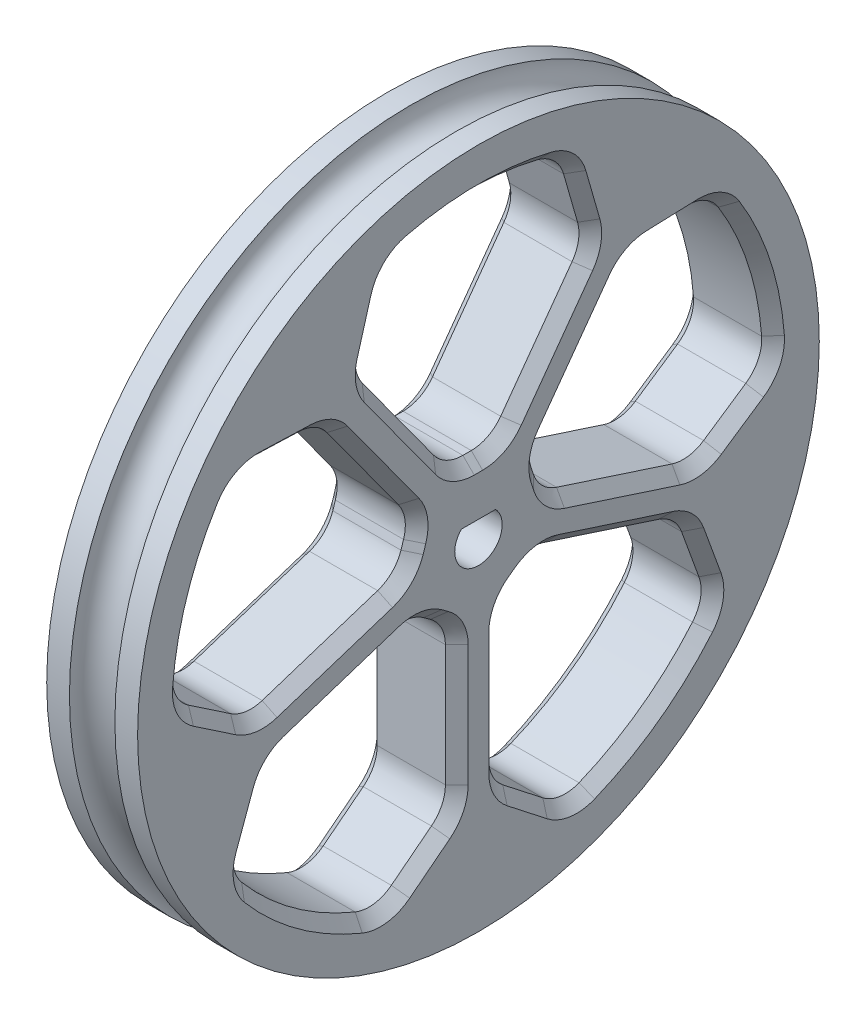
from build123d import *

# Parameters (mm, degrees)
CUT_EXTRUDE1_REACH             = 35.825
CUT_EXTRUDE1_DIRECTION_2_REACH = 35.825
CUT_EXTRUDE2_REACH             = 35.825
CUT_EXTRUDE2_DIRECTION_2_REACH = 35.825
FILLET1_R                      = 2.54
CHAMFER1_SIZE                  = 0.79375
CIRPATTERN3_COUNT              = 5
FILLET1_OF_CIRPATTERN3_R       = 2.54
CHAMFER1_OF_CIRPATTERN3_SIZE   = 0.79375


with BuildPart() as part:
    # Sketch1 → Revolve1 (revolve)
    with BuildSketch(Plane.XY):
        with BuildLine():
            Line((-3.175000000000003, 23.8125), (-1.5875, 23.8125))
            ThreePointArc((-1.5875, 23.8125), (-2.9e-16, 22.225), (1.5875, 23.8125))
            Line((1.5875, 23.8125), (3.175000000000003, 23.8125))
            Line((3.175000000000003, 23.8125), (3.175000000000018, 0))
            Line((3.175000000000018, 0), (-3.175000000000018, 0))
            Line((-3.175000000000018, 0), (-3.175000000000003, 23.8125))
        make_face()
    revolve(axis=Axis((-3.175000000000018, 0, 0), (1, 0, 0)))

    # Cut-Extrude1: up to this face of the body (flat: up to its plane)
    cut_extrude1_end = Plane(part.part.faces().sort_by_distance((3.175, 0, 0))[0])
    # Sketch3 → Cut-Extrude1 (cut, up to the picked face)
    with BuildSketch(Plane(origin=(0, 0, 0), x_dir=(0, 0, -1), z_dir=(1, 0, 0)), mode=Mode.PRIVATE) as cut_extrude1_sk1:
        with BuildLine():
            Line((8.060345380986481, 13.671607356395112), (6.35, 19.636290542004108))
            ThreePointArc((6.3500000000000005, 19.636290542004108), (-1.78e-15, 20.63749999999998), (-6.350000000000003, 19.636290542004108))
            Line((-6.35, 19.636290542004108), (-8.060345380986481, 13.67160735639511))
            Line((-8.060345380986481, 13.67160735639511), (-1.587499999999998, 4.762499999999999))
            Line((-1.587499999999998, 4.762499999999999), (1.587500000000002, 4.762499999999999))
            Line((1.5875000000000012, 4.762499999999999), (8.060345380986481, 13.671607356395112))
        make_face()
    cut_extrude1_tool1 = split(extrude(cut_extrude1_sk1.sketch, amount=CUT_EXTRUDE1_REACH, mode=Mode.PRIVATE), bisect_by=cut_extrude1_end, keep=Keep.BOTH, mode=Mode.PRIVATE)
    cut_extrude1 = cut_extrude1_tool1.solids().sort_by(Axis((0, 13.689196, 0), (1, 0, 0)))[0]
    add(cut_extrude1, mode=Mode.SUBTRACT)

    # Cut-Extrude1 direction 2: up to this face of the body (flat: up to its plane)
    cut_extrude1_direction_2_end = Plane(part.part.faces().sort_by_distance((-3.175, 0, 0))[0])
    # Sketch3 → Cut-Extrude1 direction 2 (cut, up to the picked face)
    with BuildSketch(Plane(origin=(0, 0, 0), x_dir=(0, 0, -1), z_dir=(1, 0, 0)), mode=Mode.PRIVATE) as cut_extrude1_direction_2_sk1:
        with BuildLine():
            Line((8.060345380986481, 13.671607356395112), (6.35, 19.636290542004108))
            ThreePointArc((6.3500000000000005, 19.636290542004108), (-1.78e-15, 20.63749999999998), (-6.350000000000003, 19.636290542004108))
            Line((-6.35, 19.636290542004108), (-8.060345380986481, 13.67160735639511))
            Line((-8.060345380986481, 13.67160735639511), (-1.587499999999998, 4.762499999999999))
            Line((-1.587499999999998, 4.762499999999999), (1.587500000000002, 4.762499999999999))
            Line((1.5875000000000012, 4.762499999999999), (8.060345380986481, 13.671607356395112))
        make_face()
    cut_extrude1_direction_2_tool1 = split(extrude(cut_extrude1_direction_2_sk1.sketch, amount=-CUT_EXTRUDE1_DIRECTION_2_REACH, mode=Mode.PRIVATE), bisect_by=cut_extrude1_direction_2_end, keep=Keep.BOTH, mode=Mode.PRIVATE)
    cut_extrude1_direction_2 = cut_extrude1_direction_2_tool1.solids().sort_by(Axis((0, 13.689196, 0), (-1, 0, 0)))[0]
    add(cut_extrude1_direction_2, mode=Mode.SUBTRACT)

    # Sketch3<3> → Cut-Extrude2 (cut, up to next)
    with BuildSketch(Plane(origin=(0, 0, 0), x_dir=(0, 0, -1), z_dir=(1, 0, 0)), mode=Mode.PRIVATE) as cut_extrude2_sk1:
        with BuildLine():
            Line((1.1979149789530186, 1.1437499470000003), (-1.1979149789530137, 1.143749947))
            ThreePointArc((-1.1979149789530137, 1.143749947), (-1.78e-15, -1.656250053), (1.1979149789530186, 1.1437499470000003))
        make_face()
    cut_extrude2_tool1 = extrude(cut_extrude2_sk1.sketch, amount=CUT_EXTRUDE2_REACH, mode=Mode.PRIVATE) & part.part
    add(cut_extrude2_tool1.solids().sort_by_distance((0, -0.147489, 0))[0], mode=Mode.SUBTRACT)

    # Sketch3<3> → Cut-Extrude2 direction 2 (cut, up to next)
    with BuildSketch(Plane(origin=(0, 0, 0), x_dir=(0, 0, -1), z_dir=(1, 0, 0)), mode=Mode.PRIVATE) as cut_extrude2_direction_2_sk1:
        with BuildLine():
            Line((1.1979149789530186, 1.1437499470000003), (-1.1979149789530137, 1.143749947))
            ThreePointArc((-1.1979149789530137, 1.143749947), (-1.78e-15, -1.656250053), (1.1979149789530186, 1.1437499470000003))
        make_face()
    cut_extrude2_direction_2_tool1 = extrude(cut_extrude2_direction_2_sk1.sketch, amount=-CUT_EXTRUDE2_DIRECTION_2_REACH, mode=Mode.PRIVATE) & part.part
    add(cut_extrude2_direction_2_tool1.solids().sort_by_distance((0, -0.147489, 0))[0], mode=Mode.SUBTRACT)

    # Fillet1
    fillet1_edges = [part.edges().sort_by_distance(p)[0] for p in [
        (-7.55e-15, 19.636290542004108, 6.3500000000000005),
        (-7.55e-15, 13.67160735639511, 8.060345380986481),
        (-7.55e-15, 4.762499999999999, 1.587499999999998),
        (-7.55e-15, 4.762499999999999, -1.5875000000000017),
        (-7.55e-15, 13.671607356395112, -8.060345380986481),
        (-7.55e-15, 19.636290542004108, -6.35),
    ]]
    fillet(fillet1_edges, radius=FILLET1_R)

    # Chamfer1
    chamfer1_edges = [part.edges().sort_by_distance(p)[0] for p in [
        (-3.175000000000018, 16.571235697108996, -7.228890333871329),
        (-3.175000000000018, 20.63749999999998, 4.4e-16),
        (-3.1750000000000185, 16.571235697108996, 7.2288903338713295),
        (-3.1750000000000185, 9.239444787653579, 4.840190783762263),
        (-3.175000000000018, 4.762499999999999, -2.33e-15),
        (-3.1750000000000185, 9.239444787653582, -4.840190783762267),
        (3.1750000000000034, 9.239444787653582, -4.840190783762266),
        (3.175000000000003, 4.762499999999999, -2.33e-15),
        (3.1750000000000034, 9.239444787653579, 4.840190783762263),
        (3.1750000000000034, 16.571235697108996, 7.2288903338713295),
        (3.175000000000003, 20.63749999999998, 1.11e-14),
        (3.175000000000003, 16.571235697108996, -7.228890333871329),
        (3.175000000000003, 5.039343428561543, 1.4464412276225966),
        (3.175000000000003, 13.721272285678912, 7.778681570466657),
        (3.175000000000003, 5.039343428561544, -1.4464412276226006),
        (3.175000000000003, 19.41107434572663, 6.057523546011634),
        (3.175000000000003, 13.72127228567892, -7.778681570466657),
        (3.175000000000003, 19.411074345726625, -6.057523546011632),
        (-3.175000000000018, 5.039343428561543, 1.4464412276225966),
        (-3.175000000000018, 5.039343428561544, -1.4464412276226006),
        (-3.175000000000018, 13.721272285678912, 7.778681570466657),
        (-3.175000000000018, 13.721272285678918, -7.778681570466657),
        (-3.175000000000018, 19.41107434572663, 6.057523546011634),
        (-3.175000000000018, 19.411074345726625, -6.057523546011634),
    ]]
    chamfer(chamfer1_edges, length=CHAMFER1_SIZE)

    # CirPattern3: Cut-Extrude1, Cut-Extrude1 direction 2 ×5 about axis
    cirpattern3_axis = Axis((-1.5875, 0, 0), (-1, 0, 0))
    add([cut_extrude1.rotate(cirpattern3_axis, i * 360 / CIRPATTERN3_COUNT) for i in range(1, CIRPATTERN3_COUNT)], mode=Mode.SUBTRACT)
    add([cut_extrude1_direction_2.rotate(cirpattern3_axis, i * 360 / CIRPATTERN3_COUNT) for i in range(1, CIRPATTERN3_COUNT)], mode=Mode.SUBTRACT)

    # Fillet1 of CirPattern3
    fillet1_of_cirpattern3_edges = [part.edges().sort_by_distance(p)[0] for p in [
        (-7.55e-15, 12.107156362437543, -16.712964161556982),
        (-7.55e-15, 11.890603011724373, -10.511687561271895),
        (-7.55e-15, 2.9814956553292413, -4.038842180285439),
        (-7.55e-15, -0.03810878390787087, -5.019971137425897),
        (-7.55e-15, -3.4410849846290965, -15.493254967784763),
        (-7.55e-15, 0.02873860548909324, -20.637479990118813),
        (-7.55e-15, -12.153656402908165, -16.679179904601106),
        (-7.55e-15, -6.322810548417581, -14.556925572972006),
        (-7.55e-15, -2.919834347696386, -4.08364174261313),
        (-7.55e-15, -4.7860525237249885, -1.5150127854726732),
        (-7.55e-15, -15.798314835072805, -1.5150127854726616),
        (-7.55e-15, -19.618529107022574, -6.404664076039276),
        (-7.77e-15, -19.618529107022578, 6.4046640760392695),
        (-7.77e-15, -15.798314835072805, 1.5150127854726563),
        (-7.77e-15, -4.786052523724987, 1.515012785472675),
        (-7.77e-15, -2.9198343476963853, 4.083641742613133),
        (-7.77e-15, -6.322810548417588, 14.556925572972006),
        (-7.77e-15, -12.153656402908169, 16.679179904601103),
        (-7.55e-15, 0.02873860548908702, 20.637479990118816),
        (-7.55e-15, -3.441084984629101, 15.493254967784761),
        (-7.55e-15, -0.03810878390786843, 5.019971137425896),
        (-7.55e-15, 2.981495655329244, 4.038842180285439),
        (-7.55e-15, 11.890603011724371, 10.511687561271899),
        (-7.55e-15, 12.10715636243754, 16.712964161556986),
    ]]
    fillet(fillet1_of_cirpattern3_edges, radius=FILLET1_OF_CIRPATTERN3_R)

    # Chamfer1 of CirPattern3
    chamfer1_of_cirpattern3_edges = [part.edges().sort_by_distance(p)[0] for p in [
        (-3.175000000000018, -1.7542898094119161, -17.9940316564374),
        (-3.175000000000018, 6.377338221412972, -19.627428855041213),
        (-3.1750000000000185, 11.995876705810835, -13.526331729159342),
        (-3.1750000000000185, 7.45844044298283, -7.291532964047692),
        (-3.175000000000018, 1.4716934357106848, -4.5294066588556685),
        (-3.1750000000000185, -1.7481495270348661, -10.282935380446766),
        (3.1750000000000034, -1.7481495270348653, -10.282935380446766),
        (3.175000000000003, 1.4716934357106848, -4.5294066588556685),
        (3.1750000000000034, 7.45844044298283, -7.291532964047692),
        (3.1750000000000034, 11.995876705810835, -13.526331729159342),
        (3.175000000000003, 6.377338221412983, -19.62742885504121),
        (3.175000000000003, -1.7542898094119161, -17.9940316564374),
        (3.175000000000003, 2.9328901148856628, -4.3457254848826725),
        (3.175000000000003, 11.638072116498094, -10.645960620049623),
        (3.175000000000003, 0.18159540494879534, -5.239675326282563),
        (3.175000000000003, 11.759399092950783, -16.589151025249006),
        (3.175000000000003, -3.1578594750565667, -15.453450218260434),
        (3.175000000000003, 0.23730461085940302, -20.33290646433698),
        (-3.175000000000018, 2.9328901148856628, -4.3457254848826725),
        (-3.175000000000018, 0.18159540494879534, -5.239675326282563),
        (-3.175000000000018, 11.638072116498094, -10.645960620049623),
        (-3.175000000000018, -3.1578594750565676, -15.453450218260432),
        (-3.175000000000018, 11.759399092950783, -16.589151025249006),
        (-3.175000000000018, 0.23730461085940124, -20.33290646433698),
        (-3.175000000000018, -17.655446425443134, -3.8920328244485587),
        (-3.175000000000018, -16.69608822141296, -12.130418144185906),
        (-3.1750000000000185, -9.157376168064776, -15.588623085597943),
        (-3.1750000000000185, -4.629875090823367, -9.346605985634003),
        (-3.175000000000018, -3.8529434357106873, -2.7993272640429017),
        (-3.1750000000000185, -10.319860612778182, -1.5150127854726674),
        (3.1750000000000034, -10.319860612778182, -1.5150127854726683),
        (3.175000000000003, -3.8529434357106873, -2.7993272640429017),
        (3.1750000000000034, -4.629875090823367, -9.346605985634003),
        (3.1750000000000034, -9.157376168064776, -15.588623085597943),
        (3.175000000000003, -16.696088221412953, -12.130418144185915),
        (3.175000000000003, -17.655446425443134, -3.8920328244485587),
        (3.175000000000003, -3.2267176522936194, -4.1322472830567065),
        (3.175000000000003, -6.528548154160662, -14.35824707655023),
        (3.175000000000003, -4.927111296102388, -1.7918562140342191),
        (3.175000000000003, -12.14336601900836, -16.310182724120686),
        (3.175000000000003, -15.67293677295978, -1.7720759078727752),
        (3.175000000000003, -19.264412030528447, -6.5089037390210756),
        (-3.175000000000018, -3.2267176522936194, -4.1322472830567065),
        (-3.175000000000018, -4.927111296102388, -1.7918562140342191),
        (-3.175000000000018, -6.528548154160662, -14.35824707655023),
        (-3.175000000000018, -15.672936772959778, -1.7720759078727735),
        (-3.175000000000018, -12.14336601900836, -16.310182724120686),
        (-3.175000000000018, -19.264412030528447, -6.508903739021074),
        (-3.1750000000000176, -9.15737616806478, 15.588623085597941),
        (-3.1750000000000176, -16.696088221412964, 12.130418144185901),
        (-3.1750000000000185, -17.655446425443138, 3.8920328244485525),
        (-3.1750000000000185, -10.319860612778179, 1.5150127854726656),
        (-3.1750000000000176, -3.852943435710686, 2.7993272640429043),
        (-3.1750000000000185, -4.6298750908233695, 9.346605985634007),
        (3.1750000000000025, -4.62987509082337, 9.346605985634007),
        (3.1750000000000025, -3.852943435710686, 2.7993272640429043),
        (3.1750000000000025, -10.319860612778179, 1.5150127854726656),
        (3.1750000000000025, -17.655446425443138, 3.8920328244485525),
        (3.1750000000000025, -16.69608822141297, 12.130418144185892),
        (3.1750000000000025, -9.15737616806478, 15.588623085597941),
        (3.1750000000000025, -4.927111296102385, 1.7918562140342202),
        (3.1750000000000025, -15.672936772959774, 1.7720759078727664),
        (3.1750000000000025, -3.226717652293619, 4.132247283056709),
        (3.1750000000000025, -19.264412030528455, 6.508903739021071),
        (3.1750000000000025, -6.5285481541606725, 14.358247076550233),
        (3.1750000000000025, -12.143366019008363, 16.31018272412068),
        (-3.1750000000000176, -4.927111296102385, 1.7918562140342202),
        (-3.1750000000000176, -3.226717652293619, 4.132247283056709),
        (-3.1750000000000176, -15.672936772959774, 1.7720759078727664),
        (-3.1750000000000176, -6.528548154160671, 14.358247076550233),
        (-3.1750000000000176, -19.264412030528455, 6.508903739021071),
        (-3.1750000000000176, -12.143366019008361, 16.310182724120683),
        (-3.175000000000018, 11.995876705810831, 13.526331729159349),
        (-3.175000000000018, 6.377338221412968, 19.627428855041217),
        (-3.1750000000000185, -1.7542898094119215, 17.9940316564374),
        (-3.1750000000000185, -1.7481495270348657, 10.282935380446762),
        (-3.175000000000018, 1.4716934357106881, 4.529406658855668),
        (-3.1750000000000185, 7.458440442982834, 7.291532964047695),
        (3.1750000000000034, 7.458440442982833, 7.291532964047695),
        (3.175000000000003, 1.4716934357106881, 4.529406658855668),
        (3.1750000000000034, -1.7481495270348657, 10.282935380446762),
        (3.1750000000000034, -1.7542898094119215, 17.9940316564374),
        (3.175000000000003, 6.377338221412957, 19.62742885504122),
        (3.175000000000003, 11.995876705810831, 13.526331729159349),
        (3.175000000000003, 0.18159540494879756, 5.239675326282561),
        (3.175000000000003, -3.157859475056573, 15.453450218260427),
        (3.175000000000003, 2.932890114885666, 4.3457254848826725),
        (3.175000000000003, 0.2373046108593977, 20.332906464336986),
        (3.175000000000003, 11.638072116498094, 10.645960620049634),
        (3.175000000000003, 11.759399092950776, 16.589151025249006),
        (-3.175000000000018, 0.18159540494879756, 5.239675326282561),
        (-3.175000000000018, 2.932890114885666, 4.3457254848826725),
        (-3.175000000000018, -3.157859475056573, 15.453450218260427),
        (-3.175000000000018, 11.638072116498094, 10.645960620049632),
        (-3.175000000000018, 0.2373046108593977, 20.332906464336986),
        (-3.175000000000018, 11.759399092950778, 16.589151025249006),
    ]]
    chamfer(chamfer1_of_cirpattern3_edges, length=CHAMFER1_OF_CIRPATTERN3_SIZE)


solid = part.part
